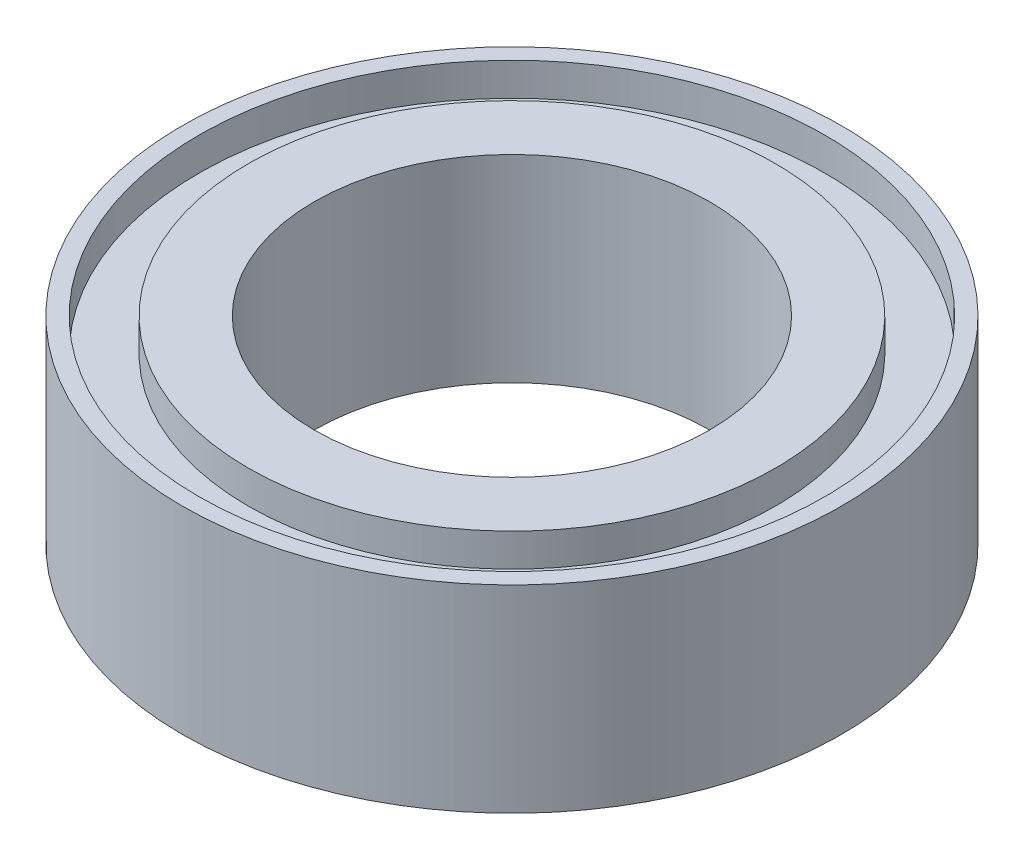
from build123d import *

# Parameters (mm, degrees)
SKETCH_1_R        = 5
SKETCH_1_R_2      = 4.75
EXTRUDE_1_DEPTH   = 1.5
SKETCH_1_R_3      = 4
SKETCH_1_R_4      = 3
EXTRUDE_1_2_DEPTH = 1.5
SKETCH_1_3_R      = 4.75
SKETCH_1_3_R_2    = 4
EXTRUDE_2_DEPTH   = 1


with BuildPart() as part:
    # 草图1 → 凸台-拉伸1 (new, symmetric)
    with BuildSketch(Plane(origin=(0, 0, 0), x_dir=(1, 0, 0), z_dir=(0, 1, 0))):
        Circle(SKETCH_1_R)
        Circle(SKETCH_1_R_2, mode=Mode.SUBTRACT)
    extrude(amount=EXTRUDE_1_DEPTH, both=True)



with BuildPart() as body_2:
    # 草图1 → Extrude 1 2 (new, symmetric)
    with BuildSketch(Plane(origin=(0, 0, 0), x_dir=(1, 0, 0), z_dir=(0, 1, 0))):
        Circle(SKETCH_1_R_3)
        Circle(SKETCH_1_R_4, mode=Mode.SUBTRACT)
    extrude(amount=EXTRUDE_1_2_DEPTH, both=True)


with BuildPart() as part_1:
    add(part.part)

    add(body_2.part)  # 凸台-拉伸2 merges body 2
    # 草图1<3> → 凸台-拉伸2 (add, symmetric)
    with BuildSketch(Plane(origin=(0, 0, 0), x_dir=(1, 0, 0), z_dir=(0, 1, 0))):
        Circle(SKETCH_1_3_R)
        Circle(SKETCH_1_3_R_2, mode=Mode.SUBTRACT)
    extrude(amount=EXTRUDE_2_DEPTH, both=True)


solid = part_1.part
